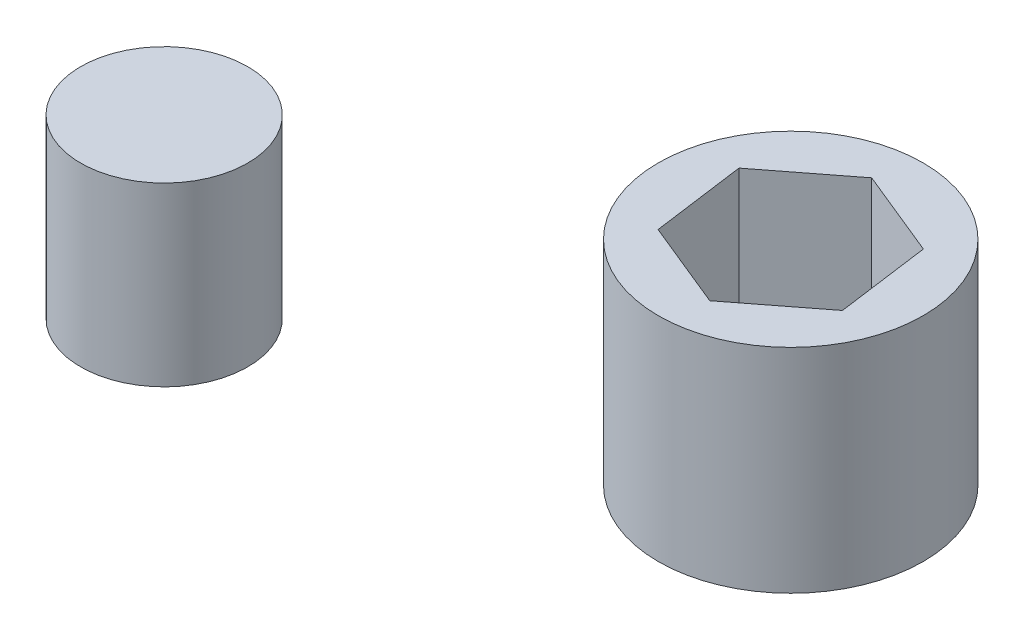
from build123d import *

# Parameters (mm, degrees)
SKETCH1_W           = 31.498362362
SKETCH1_H           = 66.521017017
SKETCH2_R           = 49.907526652
BOSS_EXTRUDE1_DEPTH = 80.264


with BuildPart() as part:
    # Sketch1 → Revolve1 (revolve)
    with BuildSketch(Plane.XY, mode=Mode.PRIVATE) as revolve1_sk:
        with Locations((15.749181181, 33.260508509)):
            Rectangle(SKETCH1_W, SKETCH1_H)
    revolve(revolve1_sk.sketch.rotate(Axis((0, 0, 0), (0, 1, 0)), 90), axis=Axis((0, 0, 0), (0, 1, 0)))


with BuildPart() as body_2:
    # Sketch2 → Boss-Extrude1 (new body)
    with BuildSketch(Plane(origin=(0, 0, 0), x_dir=(1, 0, 0), z_dir=(0, 1, 0))):
        with Locations(Location((172.422527698, 63.721368932, 0), (0, 0, 270))):
            Circle(SKETCH2_R)
        Polygon((205.40770691, 50.227431982), (200.6012095, 85.540403603), (167.616030289, 99.034340553), (139.437348487, 77.215305882), (144.243845896, 41.902334261), (177.229025108, 28.408397311), align=None, mode=Mode.SUBTRACT)
    extrude(amount=BOSS_EXTRUDE1_DEPTH)


solid = Compound([part.part, body_2.part])
